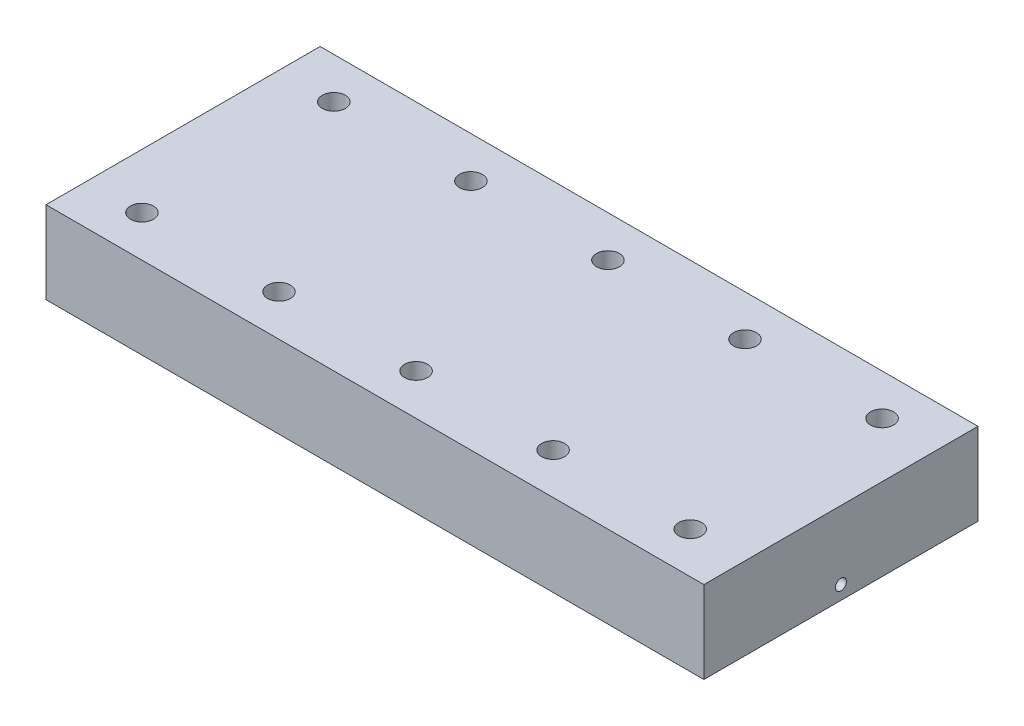
from build123d import *

# Parameters (mm, degrees)
SKETCH2_W                       = 120
SKETCH2_H                       = 50
BOSS_EXTRUDE1_DEPTH             = 15
SKIZZE7_R                       = 1.5
SCHNITT_LINEAR_AUSTRAGEN6_DEPTH = 10
SKIZZE10_W                      = 12.5
SKIZZE10_H                      = 2.5
ROTATION3_ANGLE                 = 180
SKIZZE11_W                      = 12.5
SKIZZE11_H                      = 2.5
ROTATION4_ANGLE                 = 180
SKIZZE12_R                      = 2.1
SCHNITT_LINEAR_AUSTRAGEN7_DEPTH = 83.233536557
FILLET2_R                       = 1
FILLET3_R                       = 1
FILLET4_R                       = 1
FILLET5_R                       = 1
FILLET6_R                       = 1
FILLET7_R                       = 1
SKETCH4_R                       = 1
CUT_EXTRUDE1_DEPTH              = 25
FILLET8_R                       = 1
FILLET9_R                       = 1
FILLET10_R                      = 1
FILLET11_R                      = 1


with BuildPart() as part:
    # Sketch2 → Boss-Extrude1 (new body)
    with BuildSketch(Plane(origin=(0, 0, 0), x_dir=(1, 0, 0), z_dir=(0, 1, 0))):
        with Locations((13.101876656, 9.54663752)):
            Rectangle(SKETCH2_W, SKETCH2_H)
    extrude(amount=BOSS_EXTRUDE1_DEPTH)

    # Skizze7 → Schnitt-Linear austragen6 (cut)
    with BuildSketch(Plane.ZY.offset(46.898123344)):
        with Locations((-9.54663752, 2.5)):
            Circle(SKIZZE7_R)
    extrude(amount=-SCHNITT_LINEAR_AUSTRAGEN6_DEPTH, mode=Mode.SUBTRACT)

    # Sketch3 → Schnitt-Rotation1 (revolve, cut)
    with BuildSketch(Plane(origin=(0, 0, 0), x_dir=(1, 0, 0), z_dir=(0, 1, 0))):
        Polygon((63.101876656, 9.54663752), (63.101876656, 17.04663752), (3.101876656, 17.04663752), (3.101876656, 19.54663752), (-36.898123344, 19.54663752), (-36.898123344, 9.54663752), align=None)
    revolve(axis=Axis((74.354835368, 0, -9.54663752), (-1, 0, 0)), mode=Mode.SUBTRACT)

    # Skizze10 → Rotation3 (revolve)
    with BuildSketch(Plane.XZ):
        with Locations((46.851876656, -15.79663752)):
            Rectangle(SKIZZE10_W, SKIZZE10_H)
    revolve(axis=Axis((85.744816074, 0, -9.54663752), (1, 0, 0)), revolution_arc=ROTATION3_ANGLE)

    # Skizze11 → Rotation4 (revolve)
    with BuildSketch(Plane.XZ):
        with Locations((21.851876656, -15.79663752)):
            Rectangle(SKIZZE11_W, SKIZZE11_H)
    revolve(axis=Axis((95.037830494, 0, -9.54663752), (1, 0, 0)), revolution_arc=ROTATION4_ANGLE)

    # Skizze12 → Schnitt-Linear austragen7 (cut, through all)
    with BuildSketch(Plane.XZ):
        with Locations(Location((-36.898123344, 7.95336248, 0), (0, 0, 270))):
            Circle(SKIZZE12_R)
        with Locations(Location((13.101876656, 7.95336248, 0), (0, 0, 270))):
            Circle(SKIZZE12_R)
        with Locations(Location((63.101876656, 7.95336248, 0), (0, 0, 270))):
            Circle(SKIZZE12_R)
        with Locations(Location((38.101876656, 7.95336248, 0), (0, 0, 270))):
            Circle(SKIZZE12_R)
        with Locations(Location((-11.898123344, 7.95336248, 0), (0, 0, 270))):
            Circle(SKIZZE12_R)
    schnitt_linear_austragen7 = extrude(amount=-SCHNITT_LINEAR_AUSTRAGEN7_DEPTH, mode=Mode.SUBTRACT)

    # Spiegeln1: Schnitt-Linear austragen7 across plane
    add(schnitt_linear_austragen7.mirror(Plane.XY.offset(-9.54663752)), mode=Mode.SUBTRACT)

    # Fillet2
    fillet2_edges = [part.edges().sort_by_distance(p)[0] for p in [
        (3.101876656, 7.5, -9.54663752),
    ]]
    fillet(fillet2_edges, radius=FILLET2_R)

    # Fillet3
    fillet3_edges = [part.edges().sort_by_distance(p)[0] for p in [
        (15.601876656, 5, -9.54663752),
    ]]
    fillet(fillet3_edges, radius=FILLET3_R)

    # Fillet4
    fillet4_edges = [part.edges().sort_by_distance(p)[0] for p in [
        (28.101876656, 5, -9.54663752),
    ]]
    fillet(fillet4_edges, radius=FILLET4_R)

    # Fillet5
    fillet5_edges = [part.edges().sort_by_distance(p)[0] for p in [
        (40.601876656, 5, -9.54663752),
    ]]
    fillet(fillet5_edges, radius=FILLET5_R)

    # Fillet6
    fillet6_edges = [part.edges().sort_by_distance(p)[0] for p in [
        (53.101876656, 5, -9.54663752),
    ]]
    fillet(fillet6_edges, radius=FILLET6_R)

    # Fillet7
    fillet7_edges = [part.edges().sort_by_distance(p)[0] for p in [
        (3.101876656, 10, -9.54663752),
    ]]
    fillet(fillet7_edges, radius=FILLET7_R)

    # Sketch4 → Cut-Extrude1 (cut)
    with BuildSketch(Plane(origin=(83.101876656, 0, 0), x_dir=(0, 0, -1), z_dir=(1, 0, 0))):
        with Locations((9.54663752, 2.5)):
            Circle(SKETCH4_R)
    extrude(amount=-CUT_EXTRUDE1_DEPTH, mode=Mode.SUBTRACT)

    # Fillet8
    fillet8_edges = [part.edges().sort_by_distance(p)[0] for p in [
        (15.601876656, 7.5, -9.54663752),
    ]]
    fillet(fillet8_edges, radius=FILLET8_R)

    # Fillet9
    fillet9_edges = [part.edges().sort_by_distance(p)[0] for p in [
        (28.101876656, 7.5, -9.54663752),
    ]]
    fillet(fillet9_edges, radius=FILLET9_R)

    # Fillet10
    fillet10_edges = [part.edges().sort_by_distance(p)[0] for p in [
        (40.601876656, 7.5, -9.54663752),
    ]]
    fillet(fillet10_edges, radius=FILLET10_R)

    # Fillet11
    fillet11_edges = [part.edges().sort_by_distance(p)[0] for p in [
        (53.101876656, 7.5, -9.54663752),
    ]]
    fillet(fillet11_edges, radius=FILLET11_R)


solid = part.part
